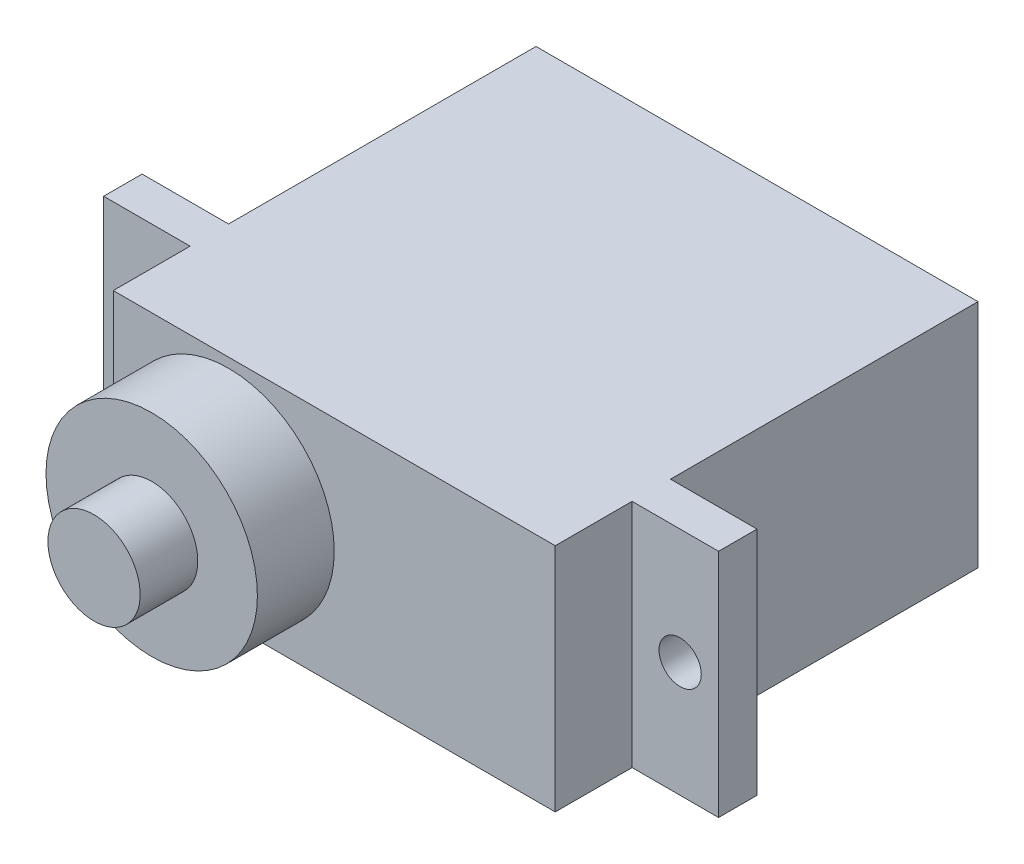
from build123d import *

# Parameters (mm, degrees)
SKETCH_1_W                            = 23
SKETCH_1_H                            = 12
SG90_CASE_PHOTO_APPROX23X12X22_DEPTH  = 22
SG90_EARS_APPROX32_START              = 16
SKETCH_2_W                            = 32
SKETCH_2_H                            = 12
SG90_EARS_APPROX32_DEPTH              = 2
SKETCH_3_R                            = 5.5
SG90_TOP_BOSS_APPROX_DEPTH            = 26
SKETCH_4_R                            = 2.4
SG90_SHAFT_ENVELOPE_NO_SPLINE_DEPTH   = 29
SG90_EAR_HOLES_REFERENCE28_DEPTH      = 34.660065359
SG90_EAR_HOLES_REFERENCE28_DEPTH_BACK = 34.660065359
SKETCH_5_R                            = 1.1


with BuildPart() as part:
    # 草图1 → SG90_case_PHOTO_APPROX23x12x22 (new body)
    with BuildSketch(Plane.XY):
        Rectangle(SKETCH_1_W, SKETCH_1_H)
    extrude(amount=SG90_CASE_PHOTO_APPROX23X12X22_DEPTH)

    # 草图2 → SG90_ears_APPROX32 (add)
    with BuildSketch(Plane.XY.offset(SG90_EARS_APPROX32_START)):
        Rectangle(SKETCH_2_W, SKETCH_2_H)
    extrude(amount=SG90_EARS_APPROX32_DEPTH)

    # 草图3 → SG90_top_boss_APPROX (add)
    with BuildSketch(Plane.XY):
        with Locations(Location((-5.5, 0, 0), (0, 0, 180))):
            Circle(SKETCH_3_R)
    extrude(amount=SG90_TOP_BOSS_APPROX_DEPTH)

    # 草图4 → SG90_shaft_envelope_NO_SPLINE (add)
    with BuildSketch(Plane.XY):
        with Locations(Location((-5.5, 0, 0), (0, 0, 180))):
            Circle(SKETCH_4_R)
    extrude(amount=SG90_SHAFT_ENVELOPE_NO_SPLINE_DEPTH)

    # 草图5 → SG90_ear_holes_REFERENCE28 (cut, two sides: drawn at the far end of the back side and taken through both)
    with BuildSketch(Plane.XY.offset(-SG90_EAR_HOLES_REFERENCE28_DEPTH_BACK)):
        with Locations((-14, 0)):
            Circle(SKETCH_5_R)
        with Locations((14, 0)):
            Circle(SKETCH_5_R)
    extrude(amount=SG90_EAR_HOLES_REFERENCE28_DEPTH + SG90_EAR_HOLES_REFERENCE28_DEPTH_BACK, mode=Mode.SUBTRACT)


solid = part.part
